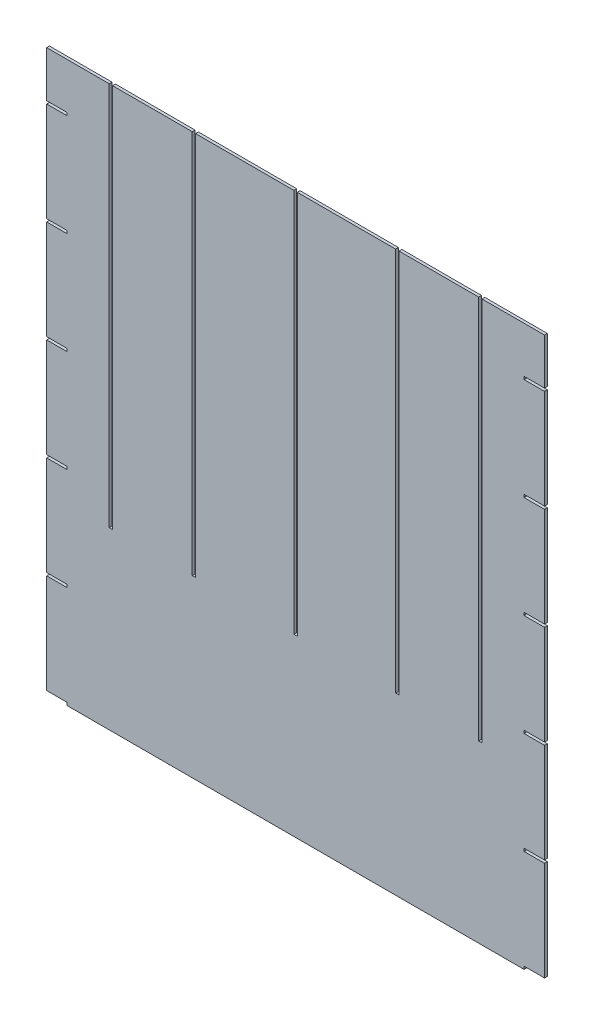
from build123d import *

# Parameters (mm, degrees)
BOSS_EXTRUDE1_DEPTH = 3


with BuildPart() as part:
    # Model → Boss-Extrude1 (new body)
    with BuildSketch(Plane.XY):
        Polygon((-268.003665543, 3), (-245.979700014, 3), (-245.979700014, 0), (245.979700014, 0), (245.979700014, 3), (268.003665543, 3), (268.003665543, 110), (245.979700014, 110), (245.979700014, 113), (268.003665543, 113), (268.003665543, 220), (245.979700014, 220), (245.979700014, 223), (268.003665543, 223), (268.003665543, 330), (245.979700014, 330), (245.979700014, 333), (268.003665543, 333), (268.003665543, 440), (245.979700014, 440), (245.979700014, 443), (268.003665543, 443), (268.003665543, 550), (245.979700014, 550), (245.979700014, 553), (268.003665543, 553), (268.003665543, 602.534821855), (200.722661621, 602.534821855), (200.722661621, 188.610331254), (197.122661621, 188.610331254), (197.122661621, 602.534821855), (111.3, 602.534821855), (111.3, 188.610331254), (107.7, 188.610331254), (107.7, 602.534821855), (1.8, 602.534821855), (1.8, 188.610331254), (-1.8, 188.610331254), (-1.8, 602.534821855), (-107.7, 602.534821855), (-107.7, 188.610331254), (-111.3, 188.610331254), (-111.3, 602.534821855), (-197.122661621, 602.534821855), (-197.122661621, 188.610331254), (-200.722661621, 188.610331254), (-200.722661621, 602.534821855), (-268.003665543, 602.534821855), (-268.003665543, 553), (-245.979700014, 553), (-245.979700014, 550), (-268.003665543, 550), (-268.003665543, 443), (-245.979700014, 443), (-245.979700014, 440), (-268.003665543, 440), (-268.003665543, 333), (-245.979700014, 333), (-245.979700014, 330), (-268.003665543, 330), (-268.003665543, 223), (-245.979700014, 223), (-245.979700014, 220), (-268.003665543, 220), (-268.003665543, 113), (-245.979700014, 113), (-245.979700014, 110), (-268.003665543, 110), align=None)
    extrude(amount=BOSS_EXTRUDE1_DEPTH)


solid = part.part
